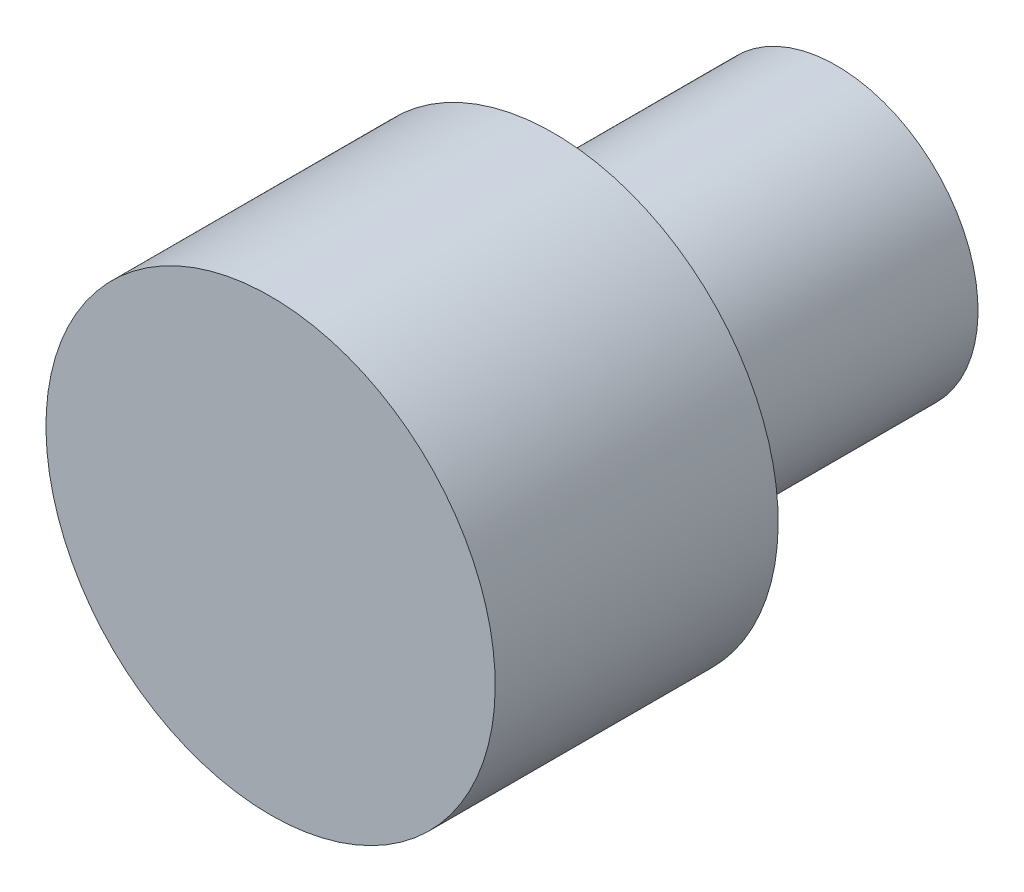
from build123d import *


with BuildPart() as part:
    # 草图1 → 旋转1 (revolve)
    with BuildSketch(Plane(origin=(0, 0, 0), x_dir=(0, 0, -1), z_dir=(1, 0, 0)), mode=Mode.PRIVATE) as revolve_1_sk:
        Polygon((0, 0), (0, 6.35), (8, 6.35), (8, 4), (16, 4), (16, 0), align=None)
    revolve(revolve_1_sk.sketch.rotate(Axis((0, 0, 0), (0, 0, -1)), 180), axis=Axis((0, 0, 0), (0, 0, -1)))


solid = part.part
